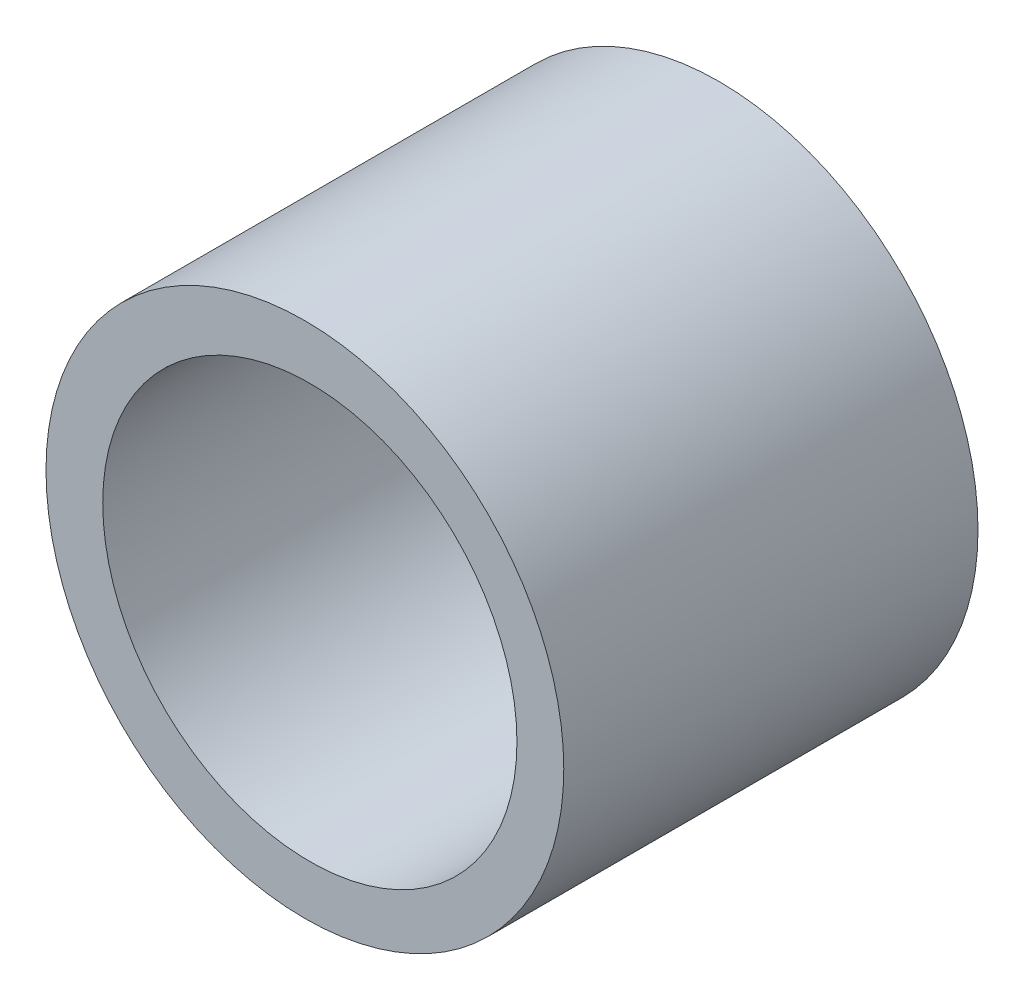
from build123d import *

# Parameters (mm, degrees)
IZIM1_R                     = 25
IZIM1_R_2                   = 20
Y_KSEKLIK_EKSTR_ZYON1_DEPTH = 20


with BuildPart() as part:
    # Çizim1 → Yükseklik-Ekstrüzyon1 (new, symmetric)
    with BuildSketch(Plane.XY):
        Circle(IZIM1_R)
        with Locations((0.478359133, 0)):
            Circle(IZIM1_R_2, mode=Mode.SUBTRACT)
    extrude(amount=Y_KSEKLIK_EKSTR_ZYON1_DEPTH, both=True)


solid = part.part
